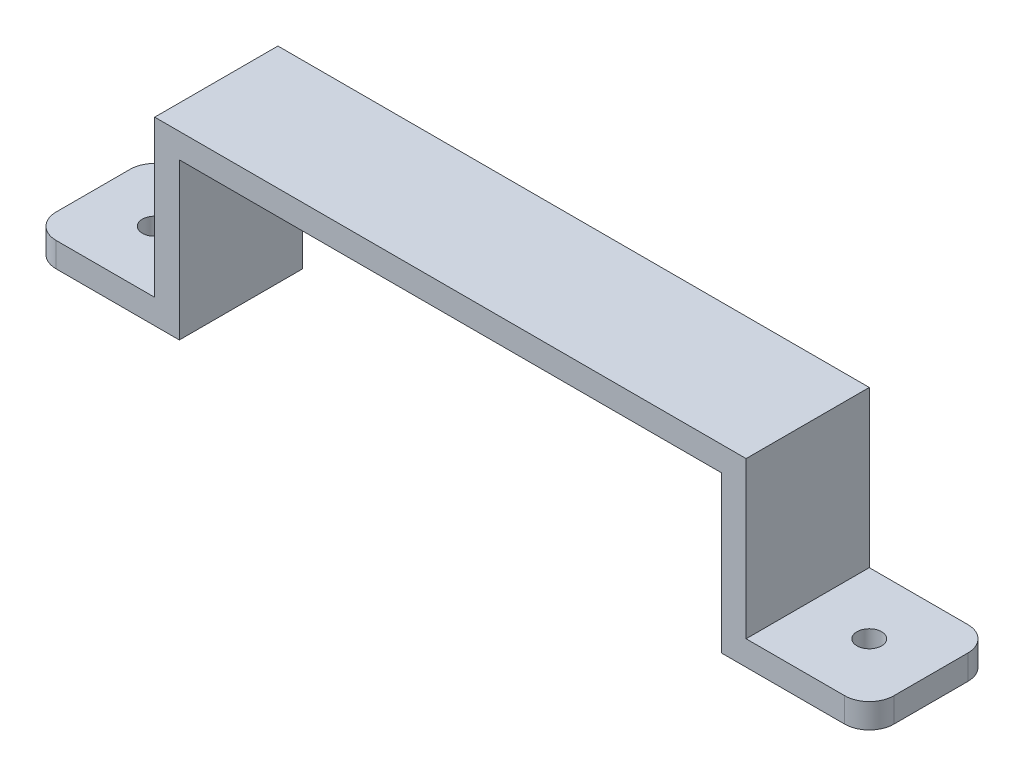
from build123d import *

# Parameters (mm, degrees)
EXTRUDE_1_DEPTH     = 15
SKETCH_2_R          = 1.5
CUT_EXTRUDE_1_DEPTH = 20
FILLET_1_R          = 3


with BuildPart() as part:
    # 草图1 → 凸台-拉伸1 (new body)
    with BuildSketch(Plane.XY):
        Polygon((-36, 0), (36, 0), (36, -19), (51, -19), (51, -22), (33, -22), (33, -3), (-33, -3), (-33, -22), (-51, -22), (-51, -19), (-36, -19), align=None)
    extrude(amount=EXTRUDE_1_DEPTH)

    # 草图2 → 切除-拉伸1 (cut)
    with BuildSketch(Plane(origin=(0, -19, 0), x_dir=(1, 0, 0), z_dir=(0, 1, 0))):
        with Locations(Location((-43.5, -7.5, 0), (0, 0, 270))):
            Circle(SKETCH_2_R)
        with Locations(Location((43.5, -7.5, 0), (0, 0, 270))):
            Circle(SKETCH_2_R)
    extrude(amount=-CUT_EXTRUDE_1_DEPTH, mode=Mode.SUBTRACT)

    # 圆角1
    fillet_1_edges = [part.edges().sort_by_distance(p)[0] for p in [
        (-51, -20.5, 15),
        (51, -20.5, 0),
        (-51, -20.5, 0),
        (51, -20.5, 15),
    ]]
    fillet(fillet_1_edges, radius=FILLET_1_R)


solid = part.part
